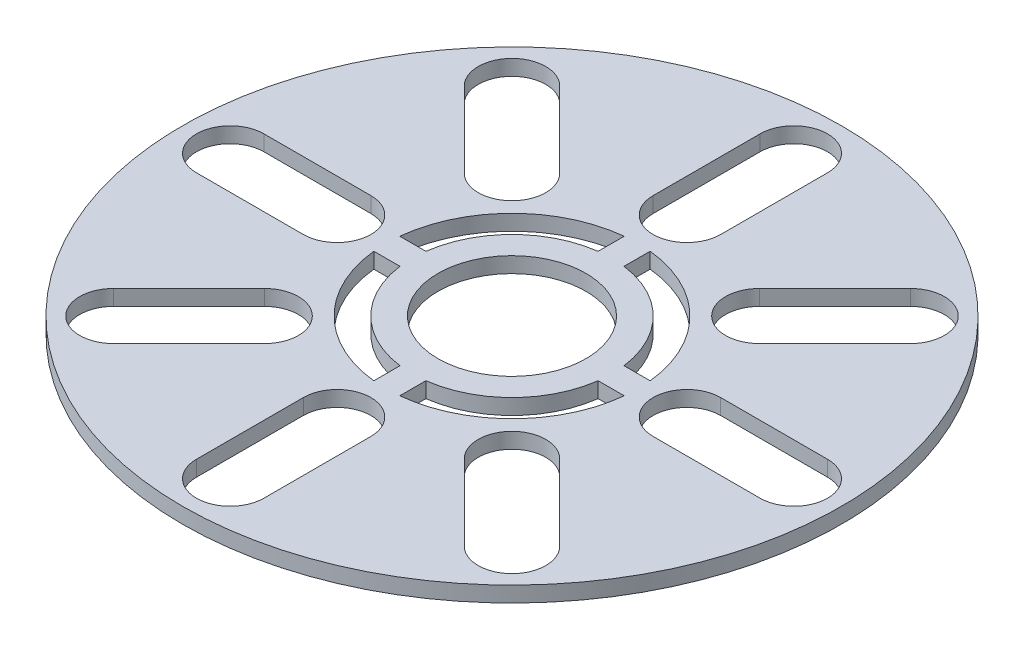
from build123d import *

# Parameters (mm, degrees)
SKETCH1_R           = 63.5
SKETCH1_R_2         = 14.25
BOSS_EXTRUDE1_DEPTH = 3
CUT_EXTRUDE1_DEPTH  = 90.852657167
CIRPATTERN1_COUNT   = 8


with BuildPart() as part:
    # Sketch1 → Boss-Extrude1 (new body)
    with BuildSketch(Plane(origin=(0, 0, 0), x_dir=(1, 0, 0), z_dir=(0, 1, 0))):
        with Locations(Location((0, 0, 0), (0, 0, 270))):
            Circle(SKETCH1_R)
        with Locations(Location((0, 0, 0), (0, 0, 270))):
            Circle(SKETCH1_R_2, mode=Mode.SUBTRACT)
        with BuildLine():
            Line((-2.5, 19.086971997), (-2.5, 24.120789788))
            ThreePointArc((-2.5, 24.120789788), (-17.147339444, 17.147339444), (-24.120789788, 2.5))
            Line((-24.120789788, 2.5), (-19.086971997, 2.5))
            ThreePointArc((-19.086971997, 2.5), (-13.611805538, 13.611805538), (-2.5, 19.086971997))
        make_face(mode=Mode.SUBTRACT)
        with BuildLine():
            Line((2.5, 19.086971997), (2.5, 24.120789788))
            ThreePointArc((2.5, 24.120789788), (17.147339444, 17.147339444), (24.120789788, 2.5))
            Line((24.120789788, 2.5), (19.086971997, 2.5))
            ThreePointArc((19.086971997, 2.5), (13.611805538, 13.611805538), (2.5, 19.086971997))
        make_face(mode=Mode.SUBTRACT)
        with BuildLine():
            Line((19.086971997, -2.5), (24.120789788, -2.5))
            ThreePointArc((24.120789788, -2.5), (17.147339444, -17.147339444), (2.5, -24.120789788))
            Line((2.5, -24.120789788), (2.5, -19.086971997))
            ThreePointArc((2.5, -19.086971997), (13.611805538, -13.611805538), (19.086971997, -2.5))
        make_face(mode=Mode.SUBTRACT)
        with BuildLine():
            Line((-2.5, -19.086971997), (-2.5, -24.120789788))
            ThreePointArc((-2.5, -24.120789788), (-17.147339444, -17.147339444), (-24.120789788, -2.5))
            Line((-24.120789788, -2.5), (-19.086971997, -2.5))
            ThreePointArc((-19.086971997, -2.5), (-13.611805538, -13.611805538), (-2.5, -19.086971997))
        make_face(mode=Mode.SUBTRACT)
    extrude(amount=BOSS_EXTRUDE1_DEPTH)

    # Sketch4 → Cut-Extrude1 (cut, through all)
    with BuildSketch(Plane(origin=(0, 3, 0), x_dir=(1, 0, 0), z_dir=(0, 1, 0))):
        with BuildLine():
            Line((-6.5, 33.7), (-6.5, 54.3))
            ThreePointArc((-6.5, 54.3), (0, 60.8), (6.5, 54.3))
            Line((6.5, 54.3), (6.5, 33.7))
            ThreePointArc((6.5, 33.7), (0, 27.2), (-6.5, 33.7))
        make_face()
    cut_extrude1 = extrude(amount=-CUT_EXTRUDE1_DEPTH, mode=Mode.SUBTRACT)

    # CirPattern1: Cut-Extrude1 ×8 about axis
    cirpattern1_axis = Axis((0, 0, 0), (0, 1, 0))
    for i in range(1, CIRPATTERN1_COUNT):
        add(cut_extrude1.rotate(cirpattern1_axis, i * 360 / CIRPATTERN1_COUNT), mode=Mode.SUBTRACT)


solid = part.part
